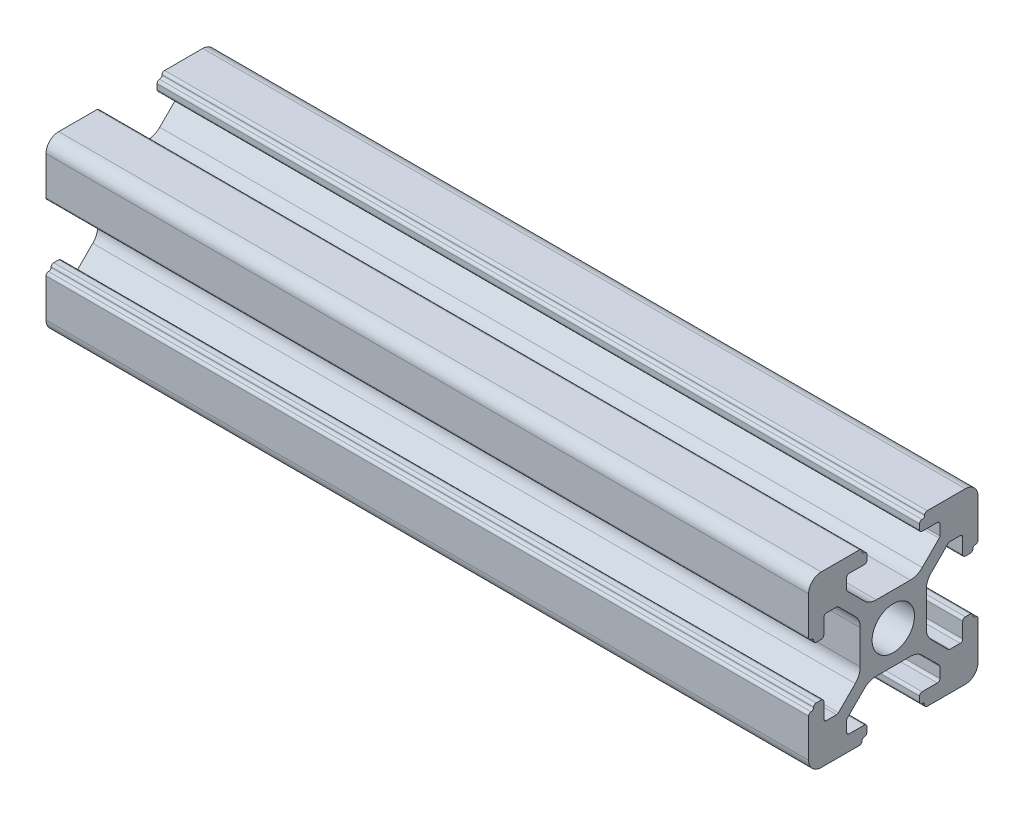
from build123d import *

# Parameters (mm, degrees)
SKETCH_1_R      = 2.5
EXTRUDE_1_DEPTH = 90


with BuildPart() as part:
    # 草图1 → 凸台-拉伸1 (new body)
    with BuildSketch(Plane(origin=(0, 0, 0), x_dir=(0, 0, -1), z_dir=(1, 0, 0))):
        with BuildLine():
            Line((10, 8.5), (10, 4))
            ThreePointArc((10, 4), (9.912132034, 3.787867966), (9.7, 3.7))
            ThreePointArc((9.7, 3.7), (9.487867966, 3.612132034), (9.4, 3.4))
            ThreePointArc((9.4, 3.4), (9.312132034, 3.187867966), (9.1, 3.1))
            Line((9.1, 3.1), (8.5, 3.1))
            ThreePointArc((8.5, 3.1), (8.287867966, 3.187867966), (8.2, 3.4))
            Line((8.2, 3.4), (8.2, 5.2))
            ThreePointArc((8.2, 5.2), (8.112132034, 5.412132034), (7.9, 5.5))
            Line((7.9, 5.5), (6.68492424, 5.5))
            ThreePointArc((6.68492424, 5.5), (6.570119211, 5.47716386), (6.472792206, 5.412132034))
            Line((6.472792206, 5.412132034), (4.485786438, 3.425126266))
            ThreePointArc((4.485786438, 3.425126266), (4.052240935, 2.776279568), (3.9, 2.010912703))
            Line((3.9, 2.010912703), (3.9, -2.010912703))
            ThreePointArc((3.9, -2.010912703), (4.052240935, -2.776279568), (4.485786438, -3.425126266))
            Line((4.485786438, -3.425126266), (6.472792206, -5.412132034))
            ThreePointArc((6.472792206, -5.412132034), (6.570119211, -5.47716386), (6.68492424, -5.5))
            Line((6.68492424, -5.5), (7.9, -5.5))
            ThreePointArc((7.9, -5.5), (8.112132034, -5.412132034), (8.2, -5.2))
            Line((8.2, -5.2), (8.2, -3.4))
            ThreePointArc((8.2, -3.4), (8.287867966, -3.187867966), (8.5, -3.1))
            Line((8.5, -3.1), (9.1, -3.1))
            ThreePointArc((9.1, -3.1), (9.312132034, -3.187867966), (9.4, -3.4))
            ThreePointArc((9.4, -3.4), (9.487867966, -3.612132034), (9.7, -3.7))
            ThreePointArc((9.7, -3.7), (9.912132034, -3.787867966), (10, -4))
            Line((10, -4), (10, -8.5))
            ThreePointArc((10, -8.5), (9.560660172, -9.560660172), (8.5, -10))
            Line((8.5, -10), (4, -10))
            ThreePointArc((4, -10), (3.787867966, -9.912132034), (3.7, -9.7))
            ThreePointArc((3.7, -9.7), (3.612132034, -9.487867966), (3.4, -9.4))
            ThreePointArc((3.4, -9.4), (3.187867966, -9.312132034), (3.1, -9.1))
            Line((3.1, -9.1), (3.1, -8.5))
            ThreePointArc((3.1, -8.5), (3.187867966, -8.287867966), (3.4, -8.2))
            Line((3.4, -8.2), (5.2, -8.2))
            ThreePointArc((5.2, -8.2), (5.412132034, -8.112132034), (5.5, -7.9))
            Line((5.5, -7.9), (5.5, -6.68492424))
            ThreePointArc((5.5, -6.68492424), (5.47716386, -6.570119211), (5.412132034, -6.472792206))
            Line((5.412132034, -6.472792206), (3.425126266, -4.485786438))
            ThreePointArc((3.425126266, -4.485786438), (2.776279568, -4.052240935), (2.010912703, -3.9))
            Line((2.010912703, -3.9), (-2.010912703, -3.9))
            ThreePointArc((-2.010912703, -3.9), (-2.776279568, -4.052240935), (-3.425126266, -4.485786438))
            Line((-3.425126266, -4.485786438), (-5.412132034, -6.472792206))
            ThreePointArc((-5.412132034, -6.472792206), (-5.47716386, -6.570119211), (-5.5, -6.68492424))
            Line((-5.5, -6.68492424), (-5.5, -7.9))
            ThreePointArc((-5.5, -7.9), (-5.412132034, -8.112132034), (-5.2, -8.2))
            Line((-5.2, -8.2), (-3.4, -8.2))
            ThreePointArc((-3.4, -8.2), (-3.187867966, -8.287867966), (-3.1, -8.5))
            Line((-3.1, -8.5), (-3.1, -9.1))
            ThreePointArc((-3.1, -9.1), (-3.187867966, -9.312132034), (-3.4, -9.4))
            ThreePointArc((-3.4, -9.4), (-3.612132034, -9.487867966), (-3.7, -9.7))
            ThreePointArc((-3.7, -9.7), (-3.787867966, -9.912132034), (-4, -10))
            Line((-4, -10), (-8.5, -10))
            ThreePointArc((-8.5, -10), (-9.560660172, -9.560660172), (-10, -8.5))
            Line((-10, -8.5), (-10, -4))
            ThreePointArc((-10, -4), (-9.912132034, -3.787867966), (-9.7, -3.7))
            ThreePointArc((-9.7, -3.7), (-9.487867966, -3.612132034), (-9.4, -3.4))
            ThreePointArc((-9.4, -3.4), (-9.312132034, -3.187867966), (-9.1, -3.1))
            Line((-9.1, -3.1), (-8.5, -3.1))
            ThreePointArc((-8.5, -3.1), (-8.287867966, -3.187867966), (-8.2, -3.4))
            Line((-8.2, -3.4), (-8.2, -5.2))
            ThreePointArc((-8.2, -5.2), (-8.112132034, -5.412132034), (-7.9, -5.5))
            Line((-7.9, -5.5), (-6.68492424, -5.5))
            ThreePointArc((-6.68492424, -5.5), (-6.570119211, -5.47716386), (-6.472792206, -5.412132034))
            Line((-6.472792206, -5.412132034), (-4.485786438, -3.425126266))
            ThreePointArc((-4.485786438, -3.425126266), (-4.052240935, -2.776279568), (-3.9, -2.010912703))
            Line((-3.9, -2.010912703), (-3.9, 2.010912703))
            ThreePointArc((-3.9, 2.010912703), (-4.052240935, 2.776279568), (-4.485786438, 3.425126266))
            Line((-4.485786438, 3.425126266), (-6.472792206, 5.412132034))
            ThreePointArc((-6.472792206, 5.412132034), (-6.570119211, 5.47716386), (-6.68492424, 5.5))
            Line((-6.68492424, 5.5), (-7.9, 5.5))
            ThreePointArc((-7.9, 5.5), (-8.112132034, 5.412132034), (-8.2, 5.2))
            Line((-8.2, 5.2), (-8.2, 3.4))
            ThreePointArc((-8.2, 3.4), (-8.287867966, 3.187867966), (-8.5, 3.1))
            Line((-8.5, 3.1), (-9.1, 3.1))
            ThreePointArc((-9.1, 3.1), (-9.312132034, 3.187867966), (-9.4, 3.4))
            ThreePointArc((-9.4, 3.4), (-9.487867966, 3.612132034), (-9.7, 3.7))
            ThreePointArc((-9.7, 3.7), (-9.912132034, 3.787867966), (-10, 4))
            Line((-10, 4), (-10, 8.5))
            ThreePointArc((-10, 8.5), (-9.560660172, 9.560660172), (-8.5, 10))
            Line((-8.5, 10), (-4, 10))
            ThreePointArc((-4, 10), (-3.787867966, 9.912132034), (-3.7, 9.7))
            ThreePointArc((-3.7, 9.7), (-3.612132034, 9.487867966), (-3.4, 9.4))
            ThreePointArc((-3.4, 9.4), (-3.187867966, 9.312132034), (-3.1, 9.1))
            Line((-3.1, 9.1), (-3.1, 8.5))
            ThreePointArc((-3.1, 8.5), (-3.187867966, 8.287867966), (-3.4, 8.2))
            Line((-3.4, 8.2), (-5.2, 8.2))
            ThreePointArc((-5.2, 8.2), (-5.412132034, 8.112132034), (-5.5, 7.9))
            Line((-5.5, 7.9), (-5.5, 6.68492424))
            ThreePointArc((-5.5, 6.68492424), (-5.47716386, 6.570119211), (-5.412132034, 6.472792206))
            Line((-5.412132034, 6.472792206), (-3.425126266, 4.485786438))
            ThreePointArc((-3.425126266, 4.485786438), (-2.776279568, 4.052240935), (-2.010912703, 3.9))
            Line((-2.010912703, 3.9), (2.010912703, 3.9))
            ThreePointArc((2.010912703, 3.9), (2.776279568, 4.052240935), (3.425126266, 4.485786438))
            Line((3.425126266, 4.485786438), (5.412132034, 6.472792206))
            ThreePointArc((5.412132034, 6.472792206), (5.47716386, 6.570119211), (5.5, 6.68492424))
            Line((5.5, 6.68492424), (5.5, 7.9))
            ThreePointArc((5.5, 7.9), (5.412132034, 8.112132034), (5.2, 8.2))
            Line((5.2, 8.2), (3.4, 8.2))
            ThreePointArc((3.4, 8.2), (3.187867966, 8.287867966), (3.1, 8.5))
            Line((3.1, 8.5), (3.1, 9.1))
            ThreePointArc((3.1, 9.1), (3.187867966, 9.312132034), (3.4, 9.4))
            ThreePointArc((3.4, 9.4), (3.612132034, 9.487867966), (3.7, 9.7))
            ThreePointArc((3.7, 9.7), (3.787867966, 9.912132034), (4, 10))
            Line((4, 10), (8.5, 10))
            ThreePointArc((8.5, 10), (9.560660172, 9.560660172), (10, 8.5))
        make_face()
        with Locations(Location((0, 0, 0), (0, 0, 180))):
            Circle(SKETCH_1_R, mode=Mode.SUBTRACT)
    extrude(amount=EXTRUDE_1_DEPTH)


solid = part.part
